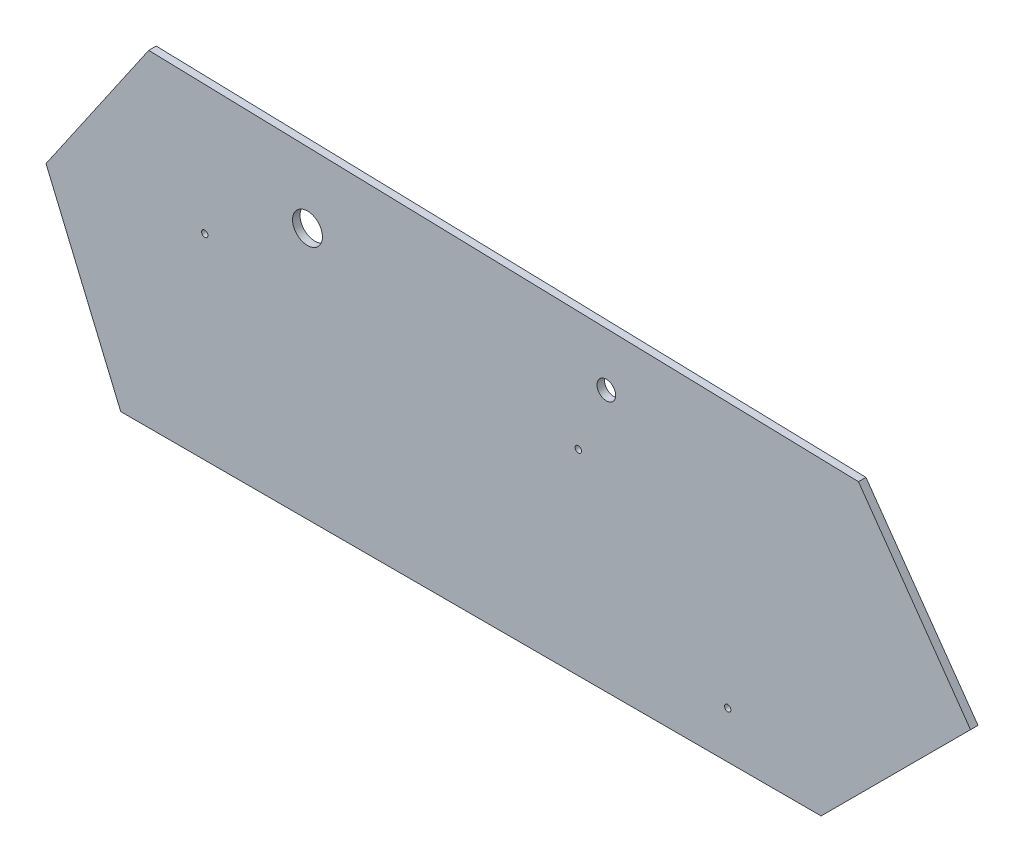
from build123d import *

# Parameters (mm, degrees)
SKETCH_1_R      = 1.7
SKETCH_1_R_2    = 8
SKETCH_1_R_3    = 5
EXTRUDE_1_DEPTH = 4


with BuildPart() as part:
    # 草图1 → 凸台-拉伸1 (new body)
    with BuildSketch(Plane.XY):
        Polygon((-125, -45), (250, -45), (330, 35), (270, 120), (-110, 130), (-165, 50), align=None)
        with Locations((-80, 60)):
            Circle(SKETCH_1_R, mode=Mode.SUBTRACT)
        with Locations((120, 60)):
            Circle(SKETCH_1_R, mode=Mode.SUBTRACT)
        with Locations((200, -20)):
            Circle(SKETCH_1_R, mode=Mode.SUBTRACT)
        with Locations((-25, 90)):
            Circle(SKETCH_1_R_2, mode=Mode.SUBTRACT)
        with Locations((135, 95)):
            Circle(SKETCH_1_R_3, mode=Mode.SUBTRACT)
    extrude(amount=EXTRUDE_1_DEPTH)


solid = part.part
